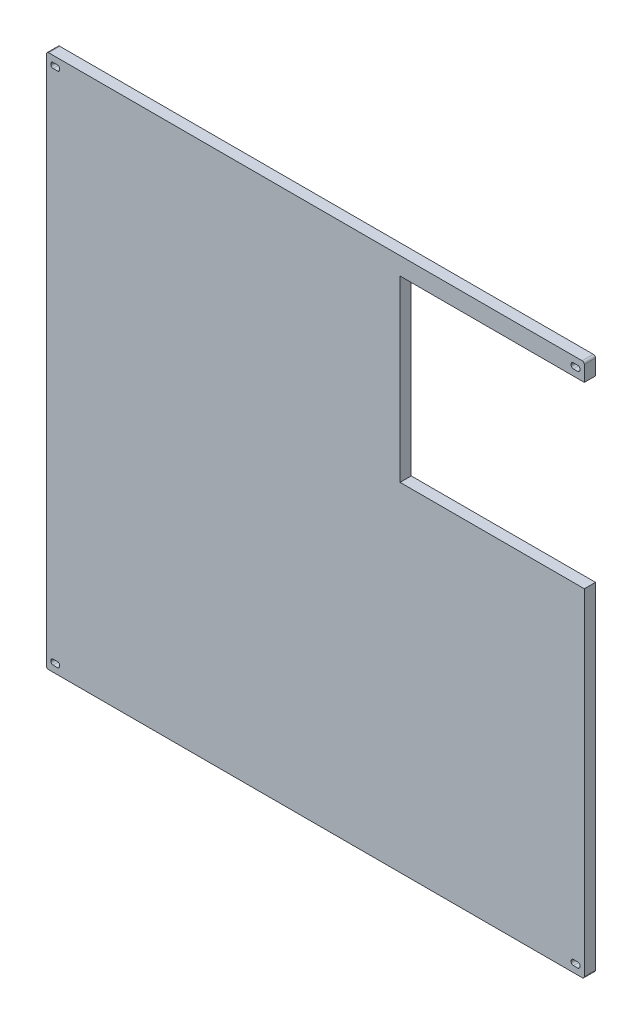
from build123d import *

# Parameters (mm, degrees)
BOSS_EXTRUDE2_DEPTH = 12.7
FILLET2_R           = 2.5


with BuildPart() as part:
    # Sketch1 → Boss-Extrude2 (new body)
    with BuildSketch(Plane.XY):
        Polygon((0, 0), (-611.632, 0), (-611.632, 607.568), (0, 607.568), (0, 587.480907233), (-209.55, 587.480907233), (-209.55, 384.280907233), (0, 384.280907233), align=None)
        with BuildLine():
            Line((-5, 10.5), (-5, 9.5))
            ThreePointArc((-5, 9.5), (-5.732233047, 7.732233047), (-7.5, 7))
            Line((-7.5, 7), (-12.5, 7))
            ThreePointArc((-12.5, 7), (-14.267766953, 7.732233047), (-15, 9.5))
            Line((-15, 9.5), (-15, 10.5))
            ThreePointArc((-15, 10.5), (-14.267766953, 12.267766953), (-12.5, 13))
            Line((-12.5, 13), (-7.5, 13))
            ThreePointArc((-7.5, 13), (-5.732233047, 12.267766953), (-5, 10.5))
        make_face(mode=Mode.SUBTRACT)
        with BuildLine():
            Line((-596.63, 10.5), (-596.63, 9.5))
            ThreePointArc((-596.63, 9.5), (-597.362233047, 7.732233047), (-599.13, 7))
            Line((-599.13, 7), (-604.13, 7))
            ThreePointArc((-604.13, 7), (-605.897766953, 7.732233047), (-606.63, 9.5))
            Line((-606.63, 9.5), (-606.63, 10.5))
            ThreePointArc((-606.63, 10.5), (-605.897766953, 12.267766953), (-604.13, 13))
            Line((-604.13, 13), (-599.13, 13))
            ThreePointArc((-599.13, 13), (-597.362233047, 12.267766953), (-596.63, 10.5))
        make_face(mode=Mode.SUBTRACT)
        with BuildLine():
            Line((-596.63, 598.07), (-596.63, 597.07))
            ThreePointArc((-596.63, 597.07), (-597.362233047, 595.302233047), (-599.13, 594.57))
            Line((-599.13, 594.57), (-604.13, 594.57))
            ThreePointArc((-604.13, 594.57), (-605.897766953, 595.302233047), (-606.63, 597.07))
            Line((-606.63, 597.07), (-606.63, 598.07))
            ThreePointArc((-606.63, 598.07), (-605.897766953, 599.837766953), (-604.13, 600.57))
            Line((-604.13, 600.57), (-599.13, 600.57))
            ThreePointArc((-599.13, 600.57), (-597.362233047, 599.837766953), (-596.63, 598.07))
        make_face(mode=Mode.SUBTRACT)
        with BuildLine():
            Line((-5, 598.07), (-5, 597.07))
            ThreePointArc((-5, 597.07), (-5.732233047, 595.302233047), (-7.5, 594.57))
            Line((-7.5, 594.57), (-12.5, 594.57))
            ThreePointArc((-12.5, 594.57), (-14.267766953, 595.302233047), (-15, 597.07))
            Line((-15, 597.07), (-15, 598.07))
            ThreePointArc((-15, 598.07), (-14.267766953, 599.837766953), (-12.5, 600.57))
            Line((-12.5, 600.57), (-7.5, 600.57))
            ThreePointArc((-7.5, 600.57), (-5.732233047, 599.837766953), (-5, 598.07))
        make_face(mode=Mode.SUBTRACT)
    extrude(amount=BOSS_EXTRUDE2_DEPTH)

    # Fillet2
    fillet2_edges = [part.edges().sort_by_distance(p)[0] for p in [
        (0, 0, 6.35),
        (-611.632, 0, 6.35),
        (-611.632, 607.568, 6.35),
        (0, 607.568, 6.35),
    ]]
    fillet(fillet2_edges, radius=FILLET2_R)


solid = part.part
